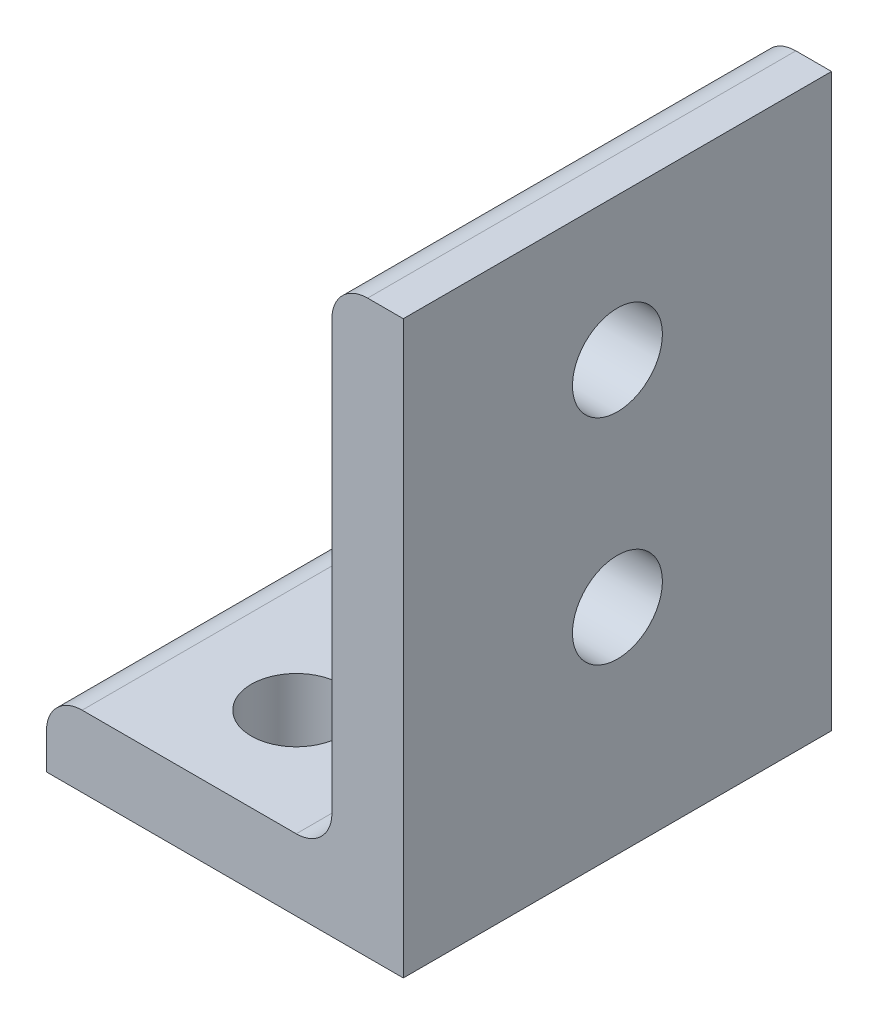
from build123d import *

# Parameters (mm, degrees)
BOSS_EXTRUDE1_DEPTH = 19.05
SKETCH3_R           = 4
CUT_EXTRUDE1_DEPTH  = 51.899122045
SKETCH4_R           = 4
CUT_EXTRUDE2_DEPTH  = 60.905780189


with BuildPart() as part:
    # Sketch2 → Boss-Extrude1 (new, symmetric)
    with BuildSketch(Plane.XY):
        with BuildLine():
            Line((-15.875, 0), (15.875, 0))
            Line((15.875, 0), (15.875, 50.8))
            Line((15.875, 50.8), (12.7, 50.8))
            ThreePointArc((12.7, 50.8), (10.45493597, 49.87006403), (9.525, 47.625))
            Line((9.525, 47.625), (9.525, 9.525))
            ThreePointArc((9.525, 9.525), (8.59506403, 7.27993597), (6.35, 6.35))
            Line((6.35, 6.35), (-12.7, 6.35))
            ThreePointArc((-12.7, 6.35), (-14.94506403, 5.42006403), (-15.875, 3.175))
            Line((-15.875, 3.175), (-15.875, 0))
        make_face()
    extrude(amount=BOSS_EXTRUDE1_DEPTH, both=True)

    # Sketch3 → Cut-Extrude1 (cut, through all)
    with BuildSketch(Plane(origin=(0, 6.35, 0), x_dir=(1, 0, 0), z_dir=(0, 1, 0))):
        with Locations(Location((-3.175, 9.525, 0), (0, 0, 180))):
            Circle(SKETCH3_R)
        with Locations(Location((-3.175, -9.525, 0), (0, 0, 180))):
            Circle(SKETCH3_R)
    extrude(amount=-CUT_EXTRUDE1_DEPTH, mode=Mode.SUBTRACT)

    # Sketch4 → Cut-Extrude2 (cut, through all)
    with BuildSketch(Plane.ZY.offset(-9.525)):
        with Locations(Location((0, 38.1, 0), (0, 0, 270))):
            Circle(SKETCH4_R)
        with Locations(Location((0, 19.05, 0), (0, 0, 90))):
            Circle(SKETCH4_R)
    extrude(amount=-CUT_EXTRUDE2_DEPTH, mode=Mode.SUBTRACT)


solid = part.part
